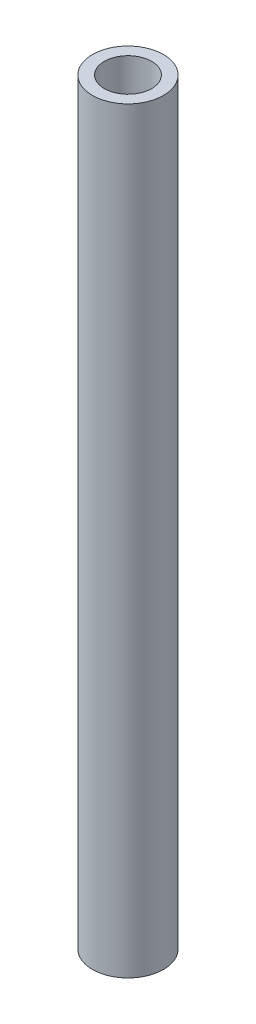
from build123d import *

# Parameters (mm, degrees)
SKETCH1_R           = 4.7625
SKETCH1_R_2         = 3.175
BOSS_EXTRUDE1_DEPTH = 101.6


with BuildPart() as part:
    # Sketch1 → Boss-Extrude1 (new body)
    with BuildSketch(Plane(origin=(0, 0, 0), x_dir=(1, 0, 0), z_dir=(0, 1, 0))):
        with Locations(Location((0, 0, 0), (0, 0, 270))):
            Circle(SKETCH1_R)
        with Locations(Location((0, 0, 0), (0, 0, 270))):
            Circle(SKETCH1_R_2, mode=Mode.SUBTRACT)
    extrude(amount=BOSS_EXTRUDE1_DEPTH)


solid = part.part
